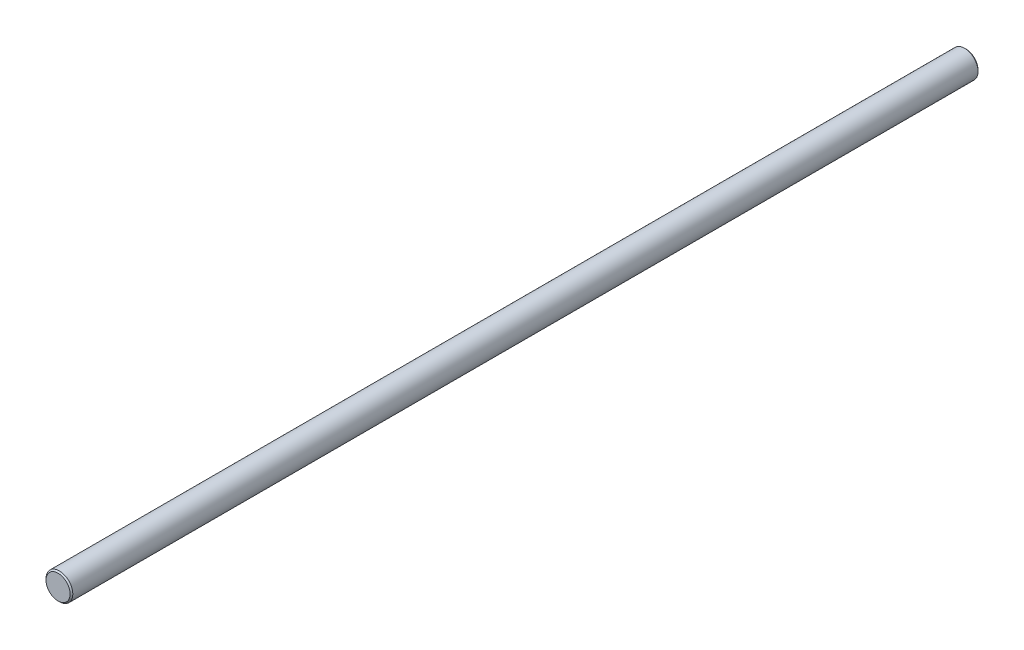
from build123d import *

# Parameters (mm, degrees)
SKETCH1_R           = 5
BOSS_EXTRUDE1_DEPTH = 339
CHAMFER1_SIZE       = 0.5


with BuildPart() as part:
    # Sketch1 → Boss-Extrude1 (new body)
    with BuildSketch(Plane.XY.offset(339)):
        Circle(SKETCH1_R)
    extrude(amount=-BOSS_EXTRUDE1_DEPTH)

    # Chamfer1
    chamfer1_edges = [part.edges().sort_by_distance(p)[0] for p in [
        (-5, 0, 0),
        (-5, 0, 339),
    ]]
    chamfer(chamfer1_edges, length=CHAMFER1_SIZE)


solid = part.part
